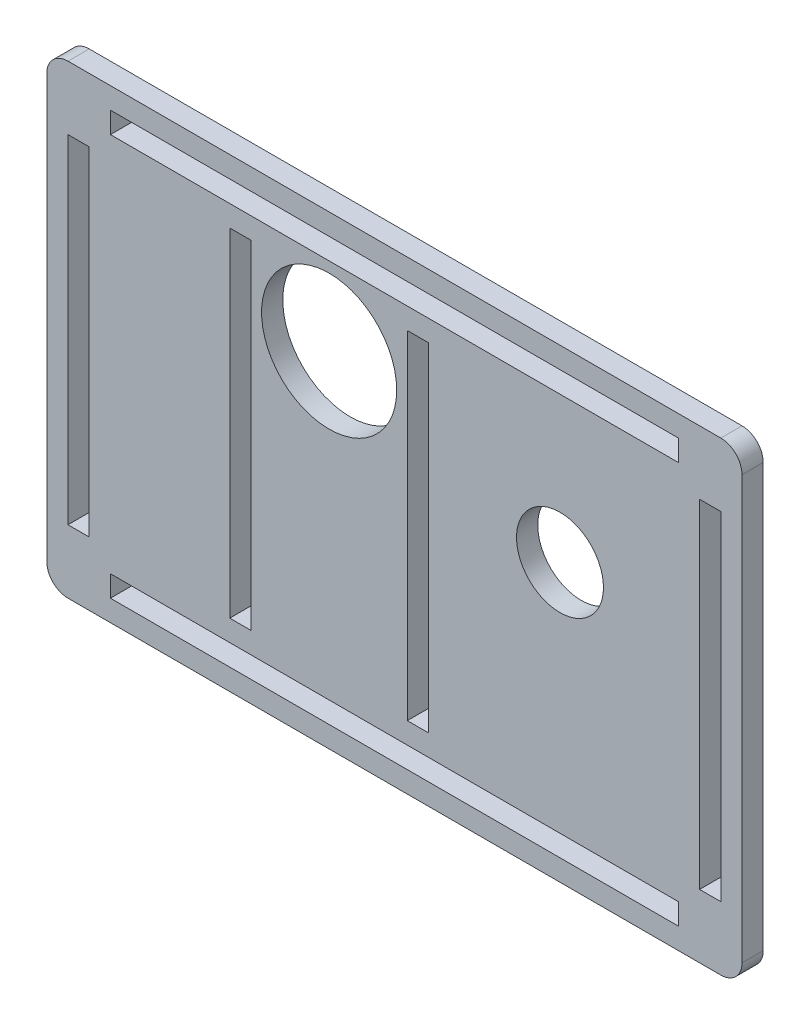
from build123d import *

# Parameters (mm, degrees)
SKETCH1_R           = 20.2311
SKETCH1_R_2         = 13.0175
SKETCH1_W           = 6.35
SKETCH1_H           = 101.1682
SKETCH1_W_2         = 170.072742275
SKETCH1_H_2         = 6.35
BOSS_EXTRUDE1_DEPTH = 6.35


with BuildPart() as part:
    # Sketch1 → Boss-Extrude1 (new body)
    with BuildSketch(Plane.XY):
        with BuildLine():
            Line((-127.583895856, -254.619594065), (67.888846419, -254.619594065))
            ThreePointArc((67.888846419, -254.619594065), (72.378974479, -252.759722126), (74.238846419, -248.269594065))
            Line((74.238846419, -248.269594065), (74.238846419, -121.701394065))
            ThreePointArc((74.238846419, -121.701394065), (72.378974479, -117.211266005), (67.888846419, -115.351394065))
            Line((67.888846419, -115.351394065), (-127.583895856, -115.351394065))
            ThreePointArc((-127.583895856, -115.351394065), (-132.074023916, -117.211266005), (-133.933895856, -121.701394065))
            Line((-133.933895856, -121.701394065), (-133.933895856, -248.269594065))
            ThreePointArc((-133.933895856, -248.269594065), (-132.074023916, -252.759722126), (-127.583895856, -254.619594065))
        make_face()
        with Locations((-49.389995856, -151.457494065)):
            Circle(SKETCH1_R, mode=Mode.SUBTRACT)
        with Locations((19.736104144, -171.688594065)):
            Circle(SKETCH1_R_2, mode=Mode.SUBTRACT)
        with Locations((-75.971095856, -184.985494065)):
            Rectangle(SKETCH1_W, SKETCH1_H, mode=Mode.SUBTRACT)
        with Locations((-124.408895856, -184.985494065)):
            Rectangle(SKETCH1_W, SKETCH1_H, mode=Mode.SUBTRACT)
        with Locations((64.713846419, -184.985494065)):
            Rectangle(SKETCH1_W, SKETCH1_H, mode=Mode.SUBTRACT)
        with Locations((-22.808895856, -184.985494065)):
            Rectangle(SKETCH1_W, SKETCH1_H, mode=Mode.SUBTRACT)
        with Locations((-29.847524719, -124.876394065)):
            Rectangle(SKETCH1_W_2, SKETCH1_H_2, mode=Mode.SUBTRACT)
        with Locations((-29.847524719, -245.094594065)):
            Rectangle(SKETCH1_W_2, SKETCH1_H_2, mode=Mode.SUBTRACT)
    extrude(amount=BOSS_EXTRUDE1_DEPTH)


solid = part.part
